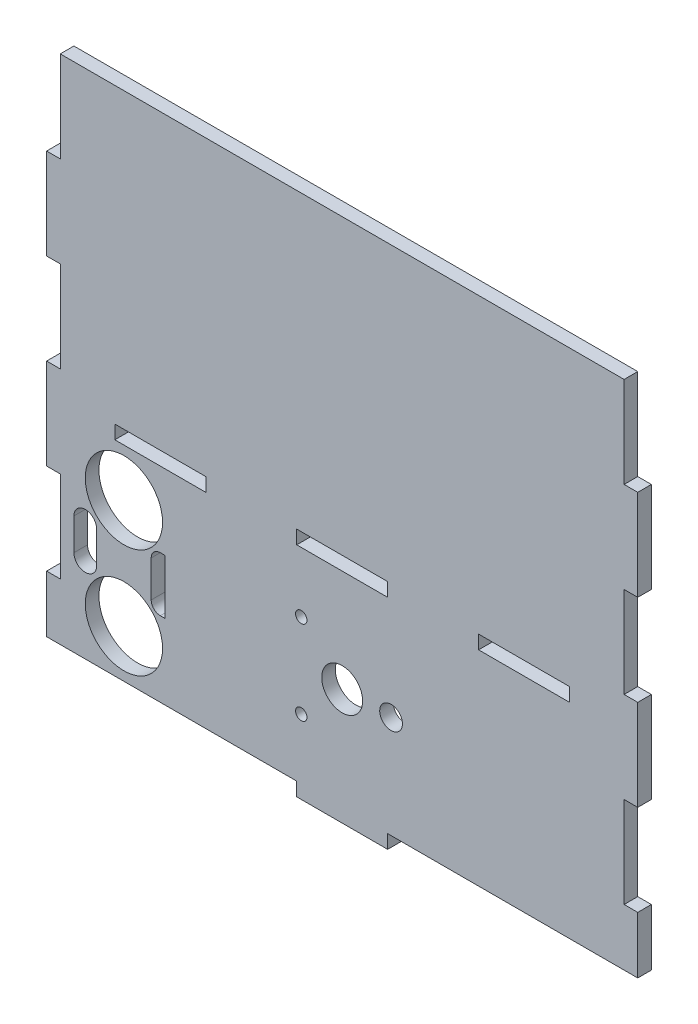
from build123d import *

# Parameters (mm, degrees)
SKETCH1_R           = 8.5
SKETCH1_R_2         = 4.5
SKETCH1_R_3         = 2.5
SKETCH1_R_4         = 1.25
SKETCH1_W           = 20
SKETCH1_H           = 3
BOSS_EXTRUDE1_DEPTH = 3


with BuildPart() as part:
    # Sketch1 → Boss-Extrude1 (new body)
    with BuildSketch(Plane.XY):
        Polygon((-10, -22.5), (-65, -22.5), (-65, -10), (-62, -10), (-62, 10), (-65, 10), (-65, 22.5), (-65, 30), (-62, 30), (-62, 50), (-65, 50), (-65, 70), (-62, 70), (-62, 90), (62, 90), (62, 70), (65, 70), (65, 50), (62, 50), (62, 30), (65, 30), (65, 22.5), (65, 10), (62, 10), (62, -10), (65, -10), (65, -22.5), (10, -22.5), (10, -25.5), (-10, -25.5), align=None)
        with Locations((-48, 12)):
            Circle(SKETCH1_R, mode=Mode.SUBTRACT)
        with Locations((-48, -12)):
            Circle(SKETCH1_R, mode=Mode.SUBTRACT)
        Circle(SKETCH1_R_2, mode=Mode.SUBTRACT)
        with Locations((10.75, 0)):
            Circle(SKETCH1_R_3, mode=Mode.SUBTRACT)
        with Locations((-9, 9.25)):
            Circle(SKETCH1_R_4, mode=Mode.SUBTRACT)
        with Locations(Location((-9, -9.25, 0), (0, 0, 180))):
            Circle(SKETCH1_R_4, mode=Mode.SUBTRACT)
        with BuildLine():
            Line((-54, 3.5), (-54, -3.5))
            ThreePointArc((-54, -3.5), (-56.5, -6), (-59, -3.5))
            Line((-59, -3.5), (-59, 3.5))
            ThreePointArc((-59, 3.5), (-56.5, 6), (-54, 3.5))
        make_face(mode=Mode.SUBTRACT)
        with BuildLine():
            Line((-39, -6), (-40, -6))
            ThreePointArc((-40, -6), (-41.414213562, -5.414213562), (-42, -4))
            Line((-42, -4), (-42, 4))
            ThreePointArc((-42, 4), (-41.414213562, 5.414213562), (-40, 6))
            Line((-40, 6), (-39, 6))
            Line((-39, 6), (-39, -6))
        make_face(mode=Mode.SUBTRACT)
        with Locations((40, 24)):
            Rectangle(SKETCH1_W, SKETCH1_H, mode=Mode.SUBTRACT)
        with Locations((0, 24)):
            Rectangle(SKETCH1_W, SKETCH1_H, mode=Mode.SUBTRACT)
        with Locations((-40, 24)):
            Rectangle(SKETCH1_W, SKETCH1_H, mode=Mode.SUBTRACT)
    extrude(amount=BOSS_EXTRUDE1_DEPTH)


solid = part.part
